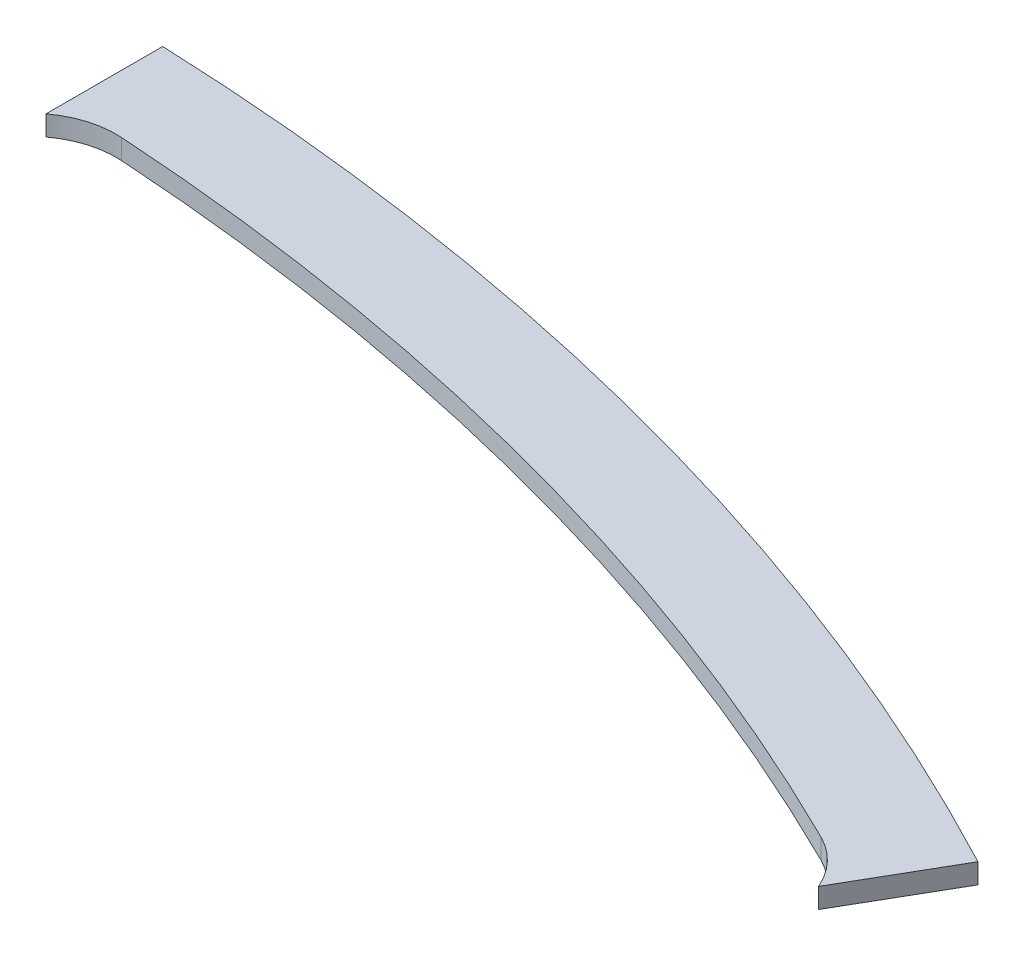
from build123d import *

# Parameters (mm, degrees)
BOSS_EXTRUDE1_DEPTH = 2.29
CUT_EXTRUDE1_DEPTH  = 3
FILLET1_R           = 10
FILLET2_R           = 3
SKETCH5_W           = 34.038972109
SKETCH5_H           = 16.711464084
CUT_EXTRUDE3_DEPTH  = 10
SKETCH6_W           = 36.357164771
SKETCH6_H           = 12.163218603
CUT_EXTRUDE4_DEPTH  = 10


with BuildPart() as part:
    # Sketch1 → Boss-Extrude1 (new body)
    with BuildSketch(Plane(origin=(0, 0, 0), x_dir=(1, 0, 0), z_dir=(0, 1, 0))):
        with BuildLine():
            Line((1.5, 297.496218463), (1.5, 271.496218463))
            ThreePointArc((1.5, 271.496218463), (70.269464473, 262.249211634), (134.449071126, 235.872622221))
            Line((134.449071126, 235.872622221), (147.449071126, 258.389282719))
            ThreePointArc((147.449071126, 258.389282719), (76.998665918, 287.362933321), (1.5, 297.496218463))
        make_face()
    extrude(amount=BOSS_EXTRUDE1_DEPTH)

    # Sketch3 → Cut-Extrude1 (cut)
    with BuildSketch(Plane(origin=(0, 2.29, 0), x_dir=(1, 0, 0), z_dir=(0, 1, 0))):
        with BuildLine():
            Line((7.5, 271.396751344), (129.203185143, 238.786481168))
            Line((129.203185143, 238.786481168), (136.70589842, 251.781561758))
            ThreePointArc((136.70589842, 251.781561758), (74.15175015, 276.738099028), (7.5, 286.402177897))
            Line((7.5, 286.402177897), (7.5, 271.396751344))
        make_face()
    extrude(amount=-CUT_EXTRUDE1_DEPTH, mode=Mode.SUBTRACT)

    # Fillet1
    fillet1_edges = [part.edges().sort_by_distance(p)[0] for p in [
        (7.5, 1.145, -286.402177897),
        (136.70589842, 1.145, -251.781561758),
    ]]
    fillet(fillet1_edges, radius=FILLET1_R)

    # Fillet2
    fillet2_edges = [part.edges().sort_by_distance(p)[0] for p in [
        (129.203185143, 1.145, -238.786481168),
        (7.5, 1.145, -271.396751344),
    ]]
    fillet(fillet2_edges, radius=FILLET2_R)

    # Sketch5 → Cut-Extrude3 (cut)
    with BuildSketch(Plane.ZY.offset(-1.5)):
        with Locations((-282.724414262, 1.327160447)):
            Rectangle(SKETCH5_W, SKETCH5_H)
    extrude(amount=-CUT_EXTRUDE3_DEPTH, mode=Mode.SUBTRACT)

    # Sketch6 → Cut-Extrude4 (cut)
    with BuildSketch(Plane(origin=(-1.299038106, 0, -0.75), x_dir=(0.5000000000000013, 0, -0.8660254037844379), z_dir=(0.8660254037844378, 0, 0.5000000000000012))):
        with Locations((285.46076815, 1.026498226)):
            Rectangle(SKETCH6_W, SKETCH6_H)
    extrude(amount=-CUT_EXTRUDE4_DEPTH, mode=Mode.SUBTRACT)


solid = part.part
